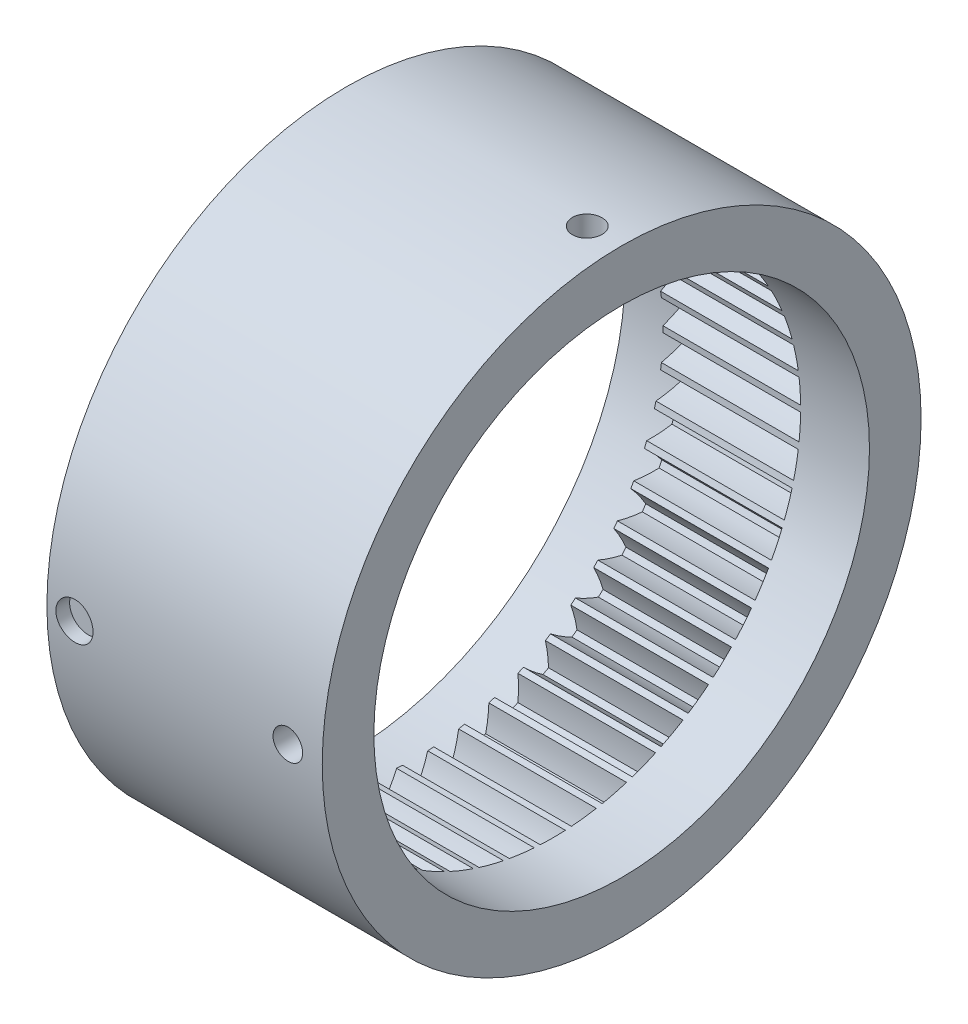
from build123d import *

# Parameters (mm, degrees)
BASPROSKE_W         = 20
BASPROSKE_H         = 7.5
TOOTHCUT_DEPTH      = 65.687711352
TEETHCUTS_COUNT     = 50
TEETHCUTS_ANGLE     = 352.8
SKETCH1_R           = 43.5
SKETCH1_R_2         = 36
BOSS_EXTRUDE1_DEPTH = 10
SKETCH2_R           = 2.15
CUT_EXTRUDE1_DEPTH  = 7
CIRPATTERN1_COUNT   = 4
SKETCH3_R           = 43.5
SKETCH3_R_2         = 40.5
BOSS_EXTRUDE2_DEPTH = 10
SKETCH4_R           = 2.7
CUT_EXTRUDE2_DEPTH  = 2


with BuildPart() as part:
    # BasProSke → Base-Revolve (revolve)
    with BuildSketch(Plane(origin=(0, 0, 0), x_dir=(1, 0, 0), z_dir=(0, 1, 0)), mode=Mode.PRIVATE) as base_revolve_sk:
        with Locations((10, 39.75)):
            Rectangle(BASPROSKE_W, BASPROSKE_H)
    revolve(base_revolve_sk.sketch.rotate(Axis((-10, 0, 0), (1, 0, 0)), 180), axis=Axis((-10, 0, 0), (1, 0, 0)))

    # TooCutSke → ToothCut (cut, through all)
    with BuildSketch(Plane(origin=(0, 0, 0), x_dir=(0, 0, -1), z_dir=(1, 0, 0))):
        with BuildLine():
            ThreePointArc((1.828725323, 35.928089413), (1.229328235, 37.684638497), (0.459205718, 39.373322264))
            ThreePointArc((0.459205718, 39.373322264), (0, 39.376), (-0.459205718, 39.373322264))
            ThreePointArc((-0.459205718, 39.373322264), (-1.229328235, 37.684638497), (-1.828725323, 35.928089413))
            ThreePointArc((-1.828725323, 35.928089413), (0, 35.9746), (1.828725323, 35.928089413))
        make_face()
    toothcut = extrude(amount=TOOTHCUT_DEPTH, mode=Mode.SUBTRACT)

    # TeethCuts: ToothCut ×50 about axis
    teethcuts_axis = Axis((-10, 0, 0), (1, 0, 0))
    for i in range(1, TEETHCUTS_COUNT):
        add(toothcut.rotate(teethcuts_axis, i * TEETHCUTS_ANGLE / (TEETHCUTS_COUNT - 1)), mode=Mode.SUBTRACT)

    # Sketch1 → Boss-Extrude1 (add)
    with BuildSketch(Plane(origin=(20, 0, 0), x_dir=(0, 0, -1), z_dir=(1, 0, 0))):
        with Locations(Location((0, 0, 0), (0, 0, 180))):
            Circle(SKETCH1_R)
        with Locations(Location((0, 0, 0), (0, 0, 179.299930609))):
            Circle(SKETCH1_R_2, mode=Mode.SUBTRACT)
    extrude(amount=BOSS_EXTRUDE1_DEPTH)

    # Sketch2 → Cut-Extrude1 (cut)
    with BuildSketch(Plane.XY.offset(43.5)):
        with Locations((25, 0)):
            Circle(SKETCH2_R)
    cut_extrude1 = extrude(amount=-CUT_EXTRUDE1_DEPTH, mode=Mode.SUBTRACT)

    # CirPattern1: Cut-Extrude1 ×4 about axis
    cirpattern1_axis = Axis((0, 0, 0), (1, 0, 0))
    for i in range(1, CIRPATTERN1_COUNT):
        add(cut_extrude1.rotate(cirpattern1_axis, i * 360 / CIRPATTERN1_COUNT), mode=Mode.SUBTRACT)

    # Sketch3 → Boss-Extrude2 (add)
    with BuildSketch(Plane.ZY):
        Circle(SKETCH3_R)
        Circle(SKETCH3_R_2, mode=Mode.SUBTRACT)
    extrude(amount=BOSS_EXTRUDE2_DEPTH)

    # Sketch4 → Cut-Extrude2 (cut)
    with BuildSketch(Plane.XY.offset(43.5)):
        with Locations((-6, 0)):
            Circle(SKETCH4_R)
    extrude(amount=-CUT_EXTRUDE2_DEPTH, mode=Mode.SUBTRACT)


solid = part.part
